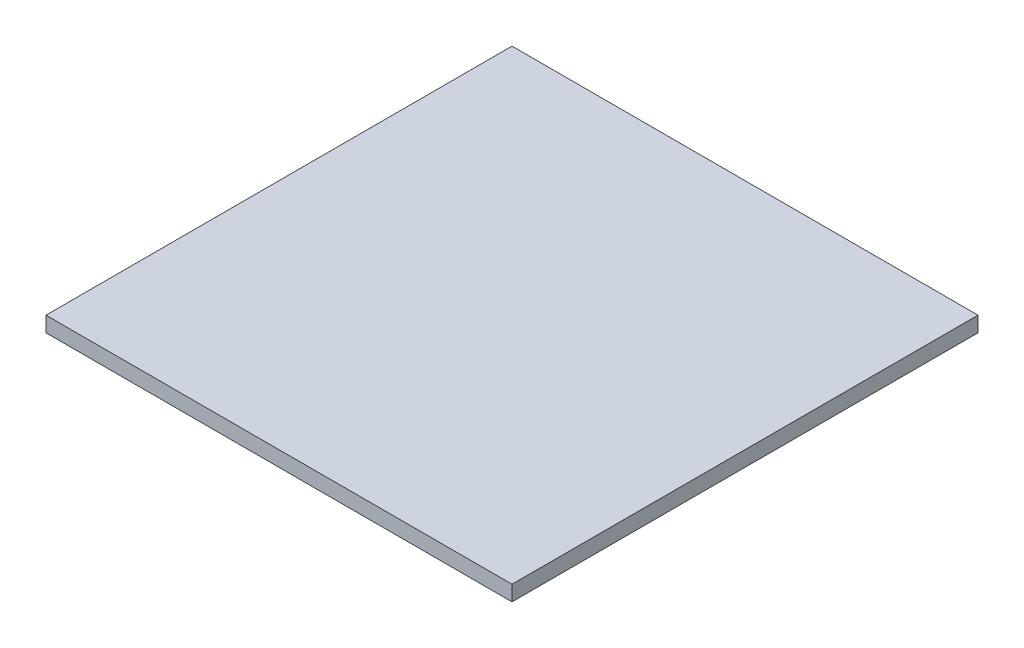
from build123d import *

# Parameters (mm, degrees)
SKETCH1_W           = 152.4
SKETCH1_H           = 5
BOSS_EXTRUDE1_DEPTH = 152.4


with BuildPart() as part:
    # Sketch1 → Boss-Extrude1 (new body)
    with BuildSketch(Plane.XY):
        Rectangle(SKETCH1_W, SKETCH1_H)
    extrude(amount=BOSS_EXTRUDE1_DEPTH)


solid = part.part
